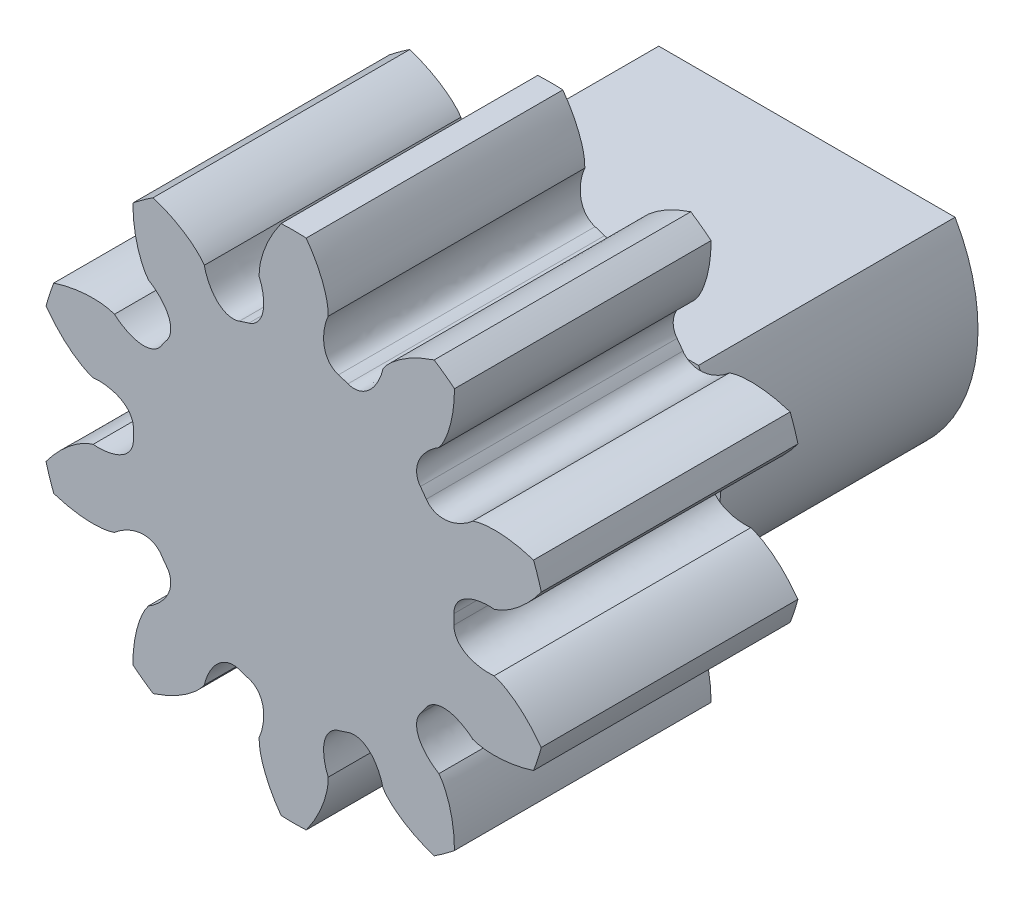
from build123d import *

# Parameters (mm, degrees)
EXTRUDE1_DEPTH = 3
EXTRUDE2_DEPTH = 3


with BuildPart() as part:
    # Sketch1 → Extrude1 (new body)
    with BuildSketch(Plane.XY):
        with BuildLine():
            ThreePointArc((0.146869466, 2.996402737), (0, 3), (-0.146869466, 2.996402737))
            add(Edge.make_bspline(
                [(-0.403675521, 2.333059462), (-0.404112154, 2.357105824), (-0.403176148, 2.381017719), (-0.400867501, 2.404795148), (-0.398490101, 2.429280686), (-0.394229221, 2.453688668), (-0.389368459, 2.477823976), (-0.384368962, 2.502648149), (-0.378071017, 2.52728395), (-0.37110821, 2.551637524), (-0.363952642, 2.57666531), (-0.355730807, 2.601447428), (-0.346865799, 2.625925798), (-0.337762187, 2.651063015), (-0.327724849, 2.675913559), (-0.317074003, 2.700437741), (-0.306144112, 2.725604439), (-0.294369, 2.750450842), (-0.282008887, 2.774948568), (-0.269333286, 2.800071589), (-0.255877409, 2.824844721), (-0.241862673, 2.84924737), (-0.227499168, 2.874257301), (-0.212406272, 2.898890217), (-0.196778524, 2.923131338), (-0.180771343, 2.94796102), (-0.164134991, 2.972384819), (-0.146869466, 2.996402737)],
                knots=[0, 0, 0, 0, 1, 1, 1, 2, 2, 2, 3, 3, 3, 4, 4, 4, 5, 5, 5, 6, 6, 6, 7, 7, 7, 8, 8, 8, 9, 9, 9, 9], degree=3))
            add(Edge.make_bspline(
                [(-0.403675521, 2.333059462), (-0.376621923, 2.271449066), (-0.359934026, 2.20843606), (-0.35361183, 2.144020444), (-0.350157456, 2.10882451), (-0.34847292, 2.072375297), (-0.352532441, 2.037176436), (-0.355230365, 2.01378356), (-0.359422143, 1.990035741), (-0.366482017, 1.967548774), (-0.371817308, 1.950554917), (-0.378380637, 1.93360758), (-0.386617062, 1.917804668), (-0.393411471, 1.904768498), (-0.4012285, 1.892002799), (-0.410113034, 1.880285367), (-0.417906201, 1.870007293), (-0.426560171, 1.860148599), (-0.435922052, 1.851272347), (-0.444507734, 1.843132029), (-0.453819157, 1.835524868), (-0.46359386, 1.828856684), (-0.472867368, 1.822530409), (-0.482746479, 1.816834329), (-0.492901586, 1.81204805), (-0.502806968, 1.80737947), (-0.51307947, 1.803487822), (-0.523719093, 1.800373103)],
                knots=[0, 0, 0, 0, 1, 1, 1, 2, 2, 2, 3, 3, 3, 4, 4, 4, 5, 5, 5, 6, 6, 6, 7, 7, 7, 8, 8, 8, 9, 9, 9, 9], degree=3))
            ThreePointArc((-0.523719093, 1.800373103), (-0.579406864, 1.783230968), (-0.634535112, 1.764366796))
            add(Edge.make_bspline(
                [(-1.044757588, 2.124759272), (-1.030430726, 2.059013708), (-1.006893403, 1.998226216), (-0.974145618, 1.942396794), (-0.956252614, 1.911892256), (-0.936191122, 1.881414077), (-0.91221753, 1.855323727), (-0.896284875, 1.837984293), (-0.878935038, 1.821235769), (-0.860005972, 1.80719312), (-0.845700893, 1.796580806), (-0.830429654, 1.786727951), (-0.814477527, 1.778784376), (-0.801318267, 1.772231546), (-0.787490667, 1.766498613), (-0.773415595, 1.762241209), (-0.76106949, 1.758506781), (-0.748273487, 1.755617607), (-0.735482235, 1.753939343), (-0.723751514, 1.752400224), (-0.711747037, 1.75171902), (-0.699919676, 1.752069771), (-0.688698759, 1.752402538), (-0.677358319, 1.753601109), (-0.666329361, 1.75569795), (-0.655571616, 1.757743227), (-0.644973533, 1.760632843), (-0.634535112, 1.764366796)],
                knots=[0, 0, 0, 0, 1, 1, 1, 2, 2, 2, 3, 3, 3, 4, 4, 4, 5, 5, 5, 6, 6, 6, 7, 7, 7, 8, 8, 8, 9, 9, 9, 9], degree=3))
            add(Edge.make_bspline(
                [(-1.044757588, 2.124759272), (-1.058538441, 2.144469834), (-1.073350746, 2.163264793), (-1.089194502, 2.181144148), (-1.105510097, 2.199555963), (-1.123303874, 2.216797953), (-1.141422691, 2.233466743), (-1.160058651, 2.25061129), (-1.179634356, 2.266840233), (-1.199582058, 2.282450053), (-1.220081997, 2.29849202), (-1.241300165, 2.313708501), (-1.262860131, 2.328301198), (-1.285000394, 2.343286664), (-1.307727555, 2.357491378), (-1.330759222, 2.371071447), (-1.354394303, 2.385007305), (-1.378524918, 2.39818723), (-1.402923862, 2.410741214), (-1.42794558, 2.423615635), (-1.453392895, 2.435748353), (-1.479074571, 2.447252856), (-1.505395359, 2.459043659), (-1.532084634, 2.470100724), (-1.558976321, 2.480526444), (-1.586520923, 2.491205293), (-1.614335964, 2.501185959), (-1.642421445, 2.510468442)],
                knots=[0, 0, 0, 0, 1, 1, 1, 2, 2, 2, 3, 3, 3, 4, 4, 4, 5, 5, 5, 6, 6, 6, 7, 7, 7, 8, 8, 8, 9, 9, 9, 9], degree=3))
            ThreePointArc((-1.642421445, 2.510468442), (-1.763355757, 2.427050983), (-1.880061232, 2.33781303))
            add(Edge.make_bspline(
                [(-1.697918301, 1.650210236), (-1.712405642, 1.669407505), (-1.725703456, 1.689302805), (-1.737811744, 1.709896138), (-1.750280624, 1.731102754), (-1.761180152, 1.75335371), (-1.771434091, 1.775736668), (-1.781980695, 1.798758476), (-1.791366112, 1.822391097), (-1.800047754, 1.846186188), (-1.808969742, 1.87064003), (-1.816884701, 1.895521857), (-1.824100784, 1.920535995), (-1.831511092, 1.9462234), (-1.837997499, 1.972227712), (-1.843795736, 1.998328602), (-1.849745882, 2.025113317), (-1.854823965, 2.052135716), (-1.859223826, 2.079219885), (-1.863735991, 2.106995368), (-1.867411239, 2.134946419), (-1.870416597, 2.162926231), (-1.873496746, 2.191602347), (-1.875765201, 2.220402176), (-1.877370661, 2.249199415), (-1.8790151, 2.278695834), (-1.879911958, 2.308233706), (-1.880061232, 2.33781303)],
                knots=[0, 0, 0, 0, 1, 1, 1, 2, 2, 2, 3, 3, 3, 4, 4, 4, 5, 5, 5, 6, 6, 6, 7, 7, 7, 8, 8, 8, 9, 9, 9, 9], degree=3))
            add(Edge.make_bspline(
                [(-1.697918301, 1.650210236), (-1.639817798, 1.616268084), (-1.589278891, 1.575098391), (-1.546301577, 1.526701157), (-1.522819279, 1.500257478), (-1.500032151, 1.471759591), (-1.482627001, 1.440896988), (-1.47105968, 1.420385953), (-1.460492282, 1.398709699), (-1.452986332, 1.37636767), (-1.447313934, 1.359483346), (-1.442662385, 1.341914835), (-1.440037074, 1.324288761), (-1.437871398, 1.309748625), (-1.436692017, 1.294826222), (-1.436992423, 1.280124423), (-1.437255927, 1.267228578), (-1.438462341, 1.254166051), (-1.440818931, 1.241482237), (-1.442980135, 1.229850044), (-1.446041858, 1.218222604), (-1.450030298, 1.207082504), (-1.453814233, 1.196513608), (-1.45845853, 1.186098587), (-1.463860879, 1.176257384), (-1.46913038, 1.166658186), (-1.475153555, 1.157471751), (-1.481930406, 1.148698077)],
                knots=[0, 0, 0, 0, 1, 1, 1, 2, 2, 2, 3, 3, 3, 4, 4, 4, 5, 5, 5, 6, 6, 6, 7, 7, 7, 8, 8, 8, 9, 9, 9, 9], degree=3))
            ThreePointArc((-1.481930406, 1.148698077), (-1.516906864, 1.102097348), (-1.550418472, 1.054432342))
            add(Edge.make_bspline(
                [(-2.094128808, 1.104873257), (-2.043893861, 1.060105097), (-1.989121775, 1.024761874), (-1.92981255, 0.998843588), (-1.897406688, 0.984682142), (-1.863261976, 0.971816627), (-1.828531409, 0.964800414), (-1.805449757, 0.960137497), (-1.781568909, 0.956785635), (-1.758000911, 0.956551119), (-1.740190097, 0.956373891), (-1.722044042, 0.957378974), (-1.704469384, 0.960328911), (-1.689971662, 0.962762379), (-1.675415165, 0.966251998), (-1.661525754, 0.971080806), (-1.649342503, 0.975316449), (-1.637292105, 0.980500359), (-1.625957306, 0.986661124), (-1.615562282, 0.992311096), (-1.605450055, 0.998816044), (-1.596087685, 1.006051757), (-1.587205368, 1.012916461), (-1.578735262, 1.020551868), (-1.571045139, 1.028730907), (-1.563544125, 1.036708815), (-1.556668569, 1.045275959), (-1.550418472, 1.054432342)],
                knots=[0, 0, 0, 0, 1, 1, 1, 2, 2, 2, 3, 3, 3, 4, 4, 4, 5, 5, 5, 6, 6, 6, 7, 7, 7, 8, 8, 8, 9, 9, 9, 9], degree=3))
            add(Edge.make_bspline(
                [(-2.094128808, 1.104873257), (-2.11686333, 1.112719255), (-2.139894136, 1.119218242), (-2.163221226, 1.124370218), (-2.187243013, 1.129675623), (-2.211773068, 1.133165767), (-2.236229168, 1.136001127), (-2.261383288, 1.138917414), (-2.286759499, 1.140540595), (-2.312072751, 1.14144424), (-2.338086782, 1.142372901), (-2.364196663, 1.142211567), (-2.390216415, 1.141344676), (-2.416936499, 1.140454453), (-2.44367248, 1.138587618), (-2.470287655, 1.136036451), (-2.497600129, 1.133418444), (-2.524869172, 1.129897608), (-2.551987379, 1.125712655), (-2.579797768, 1.121420883), (-2.607516512, 1.116278902), (-2.635055602, 1.11049093), (-2.663280026, 1.104558919), (-2.691371283, 1.097816711), (-2.719255199, 1.090444758), (-2.74781612, 1.082893818), (-2.77618545, 1.074619075), (-2.804363187, 1.06562053)],
                knots=[0, 0, 0, 0, 1, 1, 1, 2, 2, 2, 3, 3, 3, 4, 4, 4, 5, 5, 5, 6, 6, 6, 7, 7, 7, 8, 8, 8, 9, 9, 9, 9], degree=3))
            ThreePointArc((-2.804363187, 1.06562053), (-2.853169549, 0.927050983), (-2.895133509, 0.786258205))
            add(Edge.make_bspline(
                [(-2.343614001, 0.337036788), (-2.366618377, 0.344052259), (-2.389070699, 0.352331637), (-2.410970967, 0.36187492), (-2.433523439, 0.371702409), (-2.455420126, 0.383297228), (-2.476872109, 0.395378308), (-2.498936371, 0.407804203), (-2.520420238, 0.421406785), (-2.541430238, 0.435554477), (-2.563021885, 0.450093838), (-2.584050393, 0.465571363), (-2.604591269, 0.481566719), (-2.625685011, 0.497992596), (-2.646217575, 0.515217913), (-2.666250166, 0.532925858), (-2.686807596, 0.551097739), (-2.706799219, 0.569974497), (-2.726278456, 0.589299877), (-2.746254894, 0.60911853), (-2.765657447, 0.629571148), (-2.784534954, 0.650440787), (-2.803882245, 0.671829786), (-2.822645579, 0.693795973), (-2.840871015, 0.716149763), (-2.859538955, 0.73904629), (-2.877626453, 0.762415771), (-2.895133509, 0.786258205)],
                knots=[0, 0, 0, 0, 1, 1, 1, 2, 2, 2, 3, 3, 3, 4, 4, 4, 5, 5, 5, 6, 6, 6, 7, 7, 7, 8, 8, 8, 9, 9, 9, 9], degree=3))
            add(Edge.make_bspline(
                [(-2.343614001, 0.337036788), (-2.27665901, 0.343727629), (-2.211573237, 0.340126673), (-2.148356679, 0.326233919), (-2.113815897, 0.318643082), (-2.078630085, 0.308981744), (-2.04640844, 0.294243864), (-2.024994197, 0.284449189), (-2.00370401, 0.273124092), (-1.984499254, 0.259460898), (-1.969985831, 0.249135345), (-1.955896137, 0.237656232), (-1.943411869, 0.224939558), (-1.933113322, 0.214449293), (-1.923388016, 0.203070039), (-1.914989548, 0.190999459), (-1.90762274, 0.180411618), (-1.900920789, 0.169134699), (-1.895371951, 0.157488109), (-1.89028317, 0.146807143), (-1.885925718, 0.135600711), (-1.882604448, 0.124243834), (-1.879453474, 0.113469277), (-1.877088993, 0.102313499), (-1.875675072, 0.091176377), (-1.874295921, 0.080313129), (-1.87376912, 0.069340813), (-1.874094672, 0.058259429)],
                knots=[0, 0, 0, 0, 1, 1, 1, 2, 2, 2, 3, 3, 3, 4, 4, 4, 5, 5, 5, 6, 6, 6, 7, 7, 7, 8, 8, 8, 9, 9, 9, 9], degree=3))
            ThreePointArc((-1.874094672, 0.058259429), (-1.875, 0), (-1.874094672, -0.058259429))
            add(Edge.make_bspline(
                [(-2.343614001, -0.337036788), (-2.27665901, -0.343727629), (-2.211573237, -0.340126673), (-2.148356679, -0.326233919), (-2.113815897, -0.318643082), (-2.078630085, -0.308981744), (-2.04640844, -0.294243864), (-2.024994197, -0.284449189), (-2.00370401, -0.273124092), (-1.984499254, -0.259460898), (-1.969985831, -0.249135345), (-1.955896137, -0.237656232), (-1.943411869, -0.224939558), (-1.933113322, -0.214449293), (-1.923388016, -0.203070039), (-1.914989548, -0.190999459), (-1.90762274, -0.180411618), (-1.900920789, -0.169134699), (-1.895371951, -0.157488109), (-1.89028317, -0.146807143), (-1.885925718, -0.135600711), (-1.882604448, -0.124243834), (-1.879453474, -0.113469277), (-1.877088993, -0.102313499), (-1.875675072, -0.091176377), (-1.874295921, -0.080313129), (-1.87376912, -0.069340813), (-1.874094672, -0.058259429)],
                knots=[0, 0, 0, 0, 1, 1, 1, 2, 2, 2, 3, 3, 3, 4, 4, 4, 5, 5, 5, 6, 6, 6, 7, 7, 7, 8, 8, 8, 9, 9, 9, 9], degree=3))
            add(Edge.make_bspline(
                [(-2.343614001, -0.337036788), (-2.366618377, -0.344052259), (-2.389070699, -0.352331637), (-2.410970967, -0.36187492), (-2.433523439, -0.371702409), (-2.455420126, -0.383297228), (-2.476872109, -0.395378308), (-2.498936371, -0.407804203), (-2.520420238, -0.421406785), (-2.541430238, -0.435554477), (-2.563021885, -0.450093838), (-2.584050393, -0.465571363), (-2.604591269, -0.481566719), (-2.625685011, -0.497992596), (-2.646217575, -0.515217913), (-2.666250166, -0.532925858), (-2.686807596, -0.551097739), (-2.706799219, -0.569974497), (-2.726278456, -0.589299877), (-2.746254894, -0.60911853), (-2.765657447, -0.629571148), (-2.784534954, -0.650440787), (-2.803882245, -0.671829786), (-2.822645579, -0.693795973), (-2.840871015, -0.716149763), (-2.859538955, -0.73904629), (-2.877626453, -0.762415771), (-2.895133509, -0.786258205)],
                knots=[0, 0, 0, 0, 1, 1, 1, 2, 2, 2, 3, 3, 3, 4, 4, 4, 5, 5, 5, 6, 6, 6, 7, 7, 7, 8, 8, 8, 9, 9, 9, 9], degree=3))
            ThreePointArc((-2.895133509, -0.786258205), (-2.853169549, -0.927050983), (-2.804363187, -1.06562053))
            add(Edge.make_bspline(
                [(-2.094128808, -1.104873257), (-2.11686333, -1.112719255), (-2.139894136, -1.119218242), (-2.163221226, -1.124370218), (-2.187243013, -1.129675623), (-2.211773068, -1.133165767), (-2.236229168, -1.136001127), (-2.261383288, -1.138917414), (-2.286759499, -1.140540595), (-2.312072751, -1.14144424), (-2.338086782, -1.142372901), (-2.364196663, -1.142211567), (-2.390216415, -1.141344676), (-2.416936499, -1.140454453), (-2.44367248, -1.138587618), (-2.470287655, -1.136036451), (-2.497600129, -1.133418444), (-2.524869172, -1.129897608), (-2.551987379, -1.125712655), (-2.579797768, -1.121420883), (-2.607516512, -1.116278902), (-2.635055602, -1.11049093), (-2.663280026, -1.104558919), (-2.691371283, -1.097816711), (-2.719255199, -1.090444758), (-2.74781612, -1.082893818), (-2.77618545, -1.074619075), (-2.804363187, -1.06562053)],
                knots=[0, 0, 0, 0, 1, 1, 1, 2, 2, 2, 3, 3, 3, 4, 4, 4, 5, 5, 5, 6, 6, 6, 7, 7, 7, 8, 8, 8, 9, 9, 9, 9], degree=3))
            add(Edge.make_bspline(
                [(-2.094128808, -1.104873257), (-2.043893861, -1.060105097), (-1.989121775, -1.024761874), (-1.92981255, -0.998843588), (-1.897406688, -0.984682142), (-1.863261976, -0.971816627), (-1.828531409, -0.964800414), (-1.805449757, -0.960137497), (-1.781568909, -0.956785635), (-1.758000911, -0.956551119), (-1.740190097, -0.956373891), (-1.722044042, -0.957378974), (-1.704469384, -0.960328911), (-1.689971662, -0.962762379), (-1.675415165, -0.966251998), (-1.661525754, -0.971080806), (-1.649342503, -0.975316449), (-1.637292105, -0.980500359), (-1.625957306, -0.986661124), (-1.615562282, -0.992311096), (-1.605450055, -0.998816044), (-1.596087685, -1.006051757), (-1.587205368, -1.012916461), (-1.578735262, -1.020551868), (-1.571045139, -1.028730907), (-1.563544125, -1.036708815), (-1.556668569, -1.045275959), (-1.550418472, -1.054432342)],
                knots=[0, 0, 0, 0, 1, 1, 1, 2, 2, 2, 3, 3, 3, 4, 4, 4, 5, 5, 5, 6, 6, 6, 7, 7, 7, 8, 8, 8, 9, 9, 9, 9], degree=3))
            ThreePointArc((-1.550418472, -1.054432342), (-1.516906864, -1.102097348), (-1.481930406, -1.148698077))
            add(Edge.make_bspline(
                [(-1.697918301, -1.650210236), (-1.639817798, -1.616268084), (-1.589278891, -1.575098391), (-1.546301577, -1.526701157), (-1.522819279, -1.500257478), (-1.500032151, -1.471759591), (-1.482627001, -1.440896988), (-1.47105968, -1.420385953), (-1.460492282, -1.398709699), (-1.452986332, -1.37636767), (-1.447313934, -1.359483346), (-1.442662385, -1.341914835), (-1.440037074, -1.324288761), (-1.437871398, -1.309748625), (-1.436692017, -1.294826222), (-1.436992423, -1.280124423), (-1.437255927, -1.267228578), (-1.438462341, -1.254166051), (-1.440818931, -1.241482237), (-1.442980135, -1.229850044), (-1.446041858, -1.218222604), (-1.450030298, -1.207082504), (-1.453814233, -1.196513608), (-1.45845853, -1.186098587), (-1.463860879, -1.176257384), (-1.46913038, -1.166658186), (-1.475153555, -1.157471751), (-1.481930406, -1.148698077)],
                knots=[0, 0, 0, 0, 1, 1, 1, 2, 2, 2, 3, 3, 3, 4, 4, 4, 5, 5, 5, 6, 6, 6, 7, 7, 7, 8, 8, 8, 9, 9, 9, 9], degree=3))
            add(Edge.make_bspline(
                [(-1.697918301, -1.650210236), (-1.712405642, -1.669407505), (-1.725703456, -1.689302805), (-1.737811744, -1.709896138), (-1.750280624, -1.731102754), (-1.761180152, -1.75335371), (-1.771434091, -1.775736668), (-1.781980695, -1.798758476), (-1.791366112, -1.822391097), (-1.800047754, -1.846186188), (-1.808969742, -1.87064003), (-1.816884701, -1.895521857), (-1.824100784, -1.920535995), (-1.831511092, -1.9462234), (-1.837997499, -1.972227712), (-1.843795736, -1.998328602), (-1.849745882, -2.025113317), (-1.854823965, -2.052135716), (-1.859223826, -2.079219885), (-1.863735991, -2.106995368), (-1.867411239, -2.134946419), (-1.870416597, -2.162926231), (-1.873496746, -2.191602347), (-1.875765201, -2.220402176), (-1.877370661, -2.249199415), (-1.8790151, -2.278695834), (-1.879911958, -2.308233706), (-1.880061232, -2.33781303)],
                knots=[0, 0, 0, 0, 1, 1, 1, 2, 2, 2, 3, 3, 3, 4, 4, 4, 5, 5, 5, 6, 6, 6, 7, 7, 7, 8, 8, 8, 9, 9, 9, 9], degree=3))
            ThreePointArc((-1.880061232, -2.33781303), (-1.763355757, -2.427050983), (-1.642421445, -2.510468442))
            add(Edge.make_bspline(
                [(-1.044757588, -2.124759272), (-1.058538441, -2.144469834), (-1.073350746, -2.163264793), (-1.089194502, -2.181144148), (-1.105510097, -2.199555963), (-1.123303874, -2.216797953), (-1.141422691, -2.233466743), (-1.160058651, -2.25061129), (-1.179634356, -2.266840233), (-1.199582058, -2.282450053), (-1.220081997, -2.29849202), (-1.241300165, -2.313708501), (-1.262860131, -2.328301198), (-1.285000394, -2.343286664), (-1.307727555, -2.357491378), (-1.330759222, -2.371071447), (-1.354394303, -2.385007305), (-1.378524918, -2.39818723), (-1.402923862, -2.410741214), (-1.42794558, -2.423615635), (-1.453392895, -2.435748353), (-1.479074571, -2.447252856), (-1.505395359, -2.459043659), (-1.532084634, -2.470100724), (-1.558976321, -2.480526444), (-1.586520923, -2.491205293), (-1.614335964, -2.501185959), (-1.642421445, -2.510468442)],
                knots=[0, 0, 0, 0, 1, 1, 1, 2, 2, 2, 3, 3, 3, 4, 4, 4, 5, 5, 5, 6, 6, 6, 7, 7, 7, 8, 8, 8, 9, 9, 9, 9], degree=3))
            add(Edge.make_bspline(
                [(-1.044757588, -2.124759272), (-1.030430726, -2.059013708), (-1.006893403, -1.998226216), (-0.974145618, -1.942396794), (-0.956252614, -1.911892256), (-0.936191122, -1.881414077), (-0.91221753, -1.855323727), (-0.896284875, -1.837984293), (-0.878935038, -1.821235769), (-0.860005972, -1.80719312), (-0.845700893, -1.796580806), (-0.830429654, -1.786727951), (-0.814477527, -1.778784376), (-0.801318267, -1.772231546), (-0.787490667, -1.766498613), (-0.773415595, -1.762241209), (-0.76106949, -1.758506781), (-0.748273487, -1.755617607), (-0.735482235, -1.753939343), (-0.723751514, -1.752400224), (-0.711747037, -1.75171902), (-0.699919676, -1.752069771), (-0.688698759, -1.752402538), (-0.677358319, -1.753601109), (-0.666329361, -1.75569795), (-0.655571616, -1.757743227), (-0.644973533, -1.760632843), (-0.634535112, -1.764366796)],
                knots=[0, 0, 0, 0, 1, 1, 1, 2, 2, 2, 3, 3, 3, 4, 4, 4, 5, 5, 5, 6, 6, 6, 7, 7, 7, 8, 8, 8, 9, 9, 9, 9], degree=3))
            ThreePointArc((-0.634535112, -1.764366796), (-0.579406864, -1.783230968), (-0.523719093, -1.800373103))
            add(Edge.make_bspline(
                [(-0.403675521, -2.333059462), (-0.376621923, -2.271449066), (-0.359934026, -2.20843606), (-0.35361183, -2.144020444), (-0.350157456, -2.10882451), (-0.34847292, -2.072375297), (-0.352532441, -2.037176436), (-0.355230365, -2.01378356), (-0.359422143, -1.990035741), (-0.366482017, -1.967548774), (-0.371817308, -1.950554917), (-0.378380637, -1.93360758), (-0.386617062, -1.917804668), (-0.393411471, -1.904768498), (-0.4012285, -1.892002799), (-0.410113034, -1.880285367), (-0.417906201, -1.870007293), (-0.426560171, -1.860148599), (-0.435922052, -1.851272347), (-0.444507734, -1.843132029), (-0.453819157, -1.835524868), (-0.46359386, -1.828856684), (-0.472867368, -1.822530409), (-0.482746479, -1.816834329), (-0.492901586, -1.81204805), (-0.502806968, -1.80737947), (-0.51307947, -1.803487822), (-0.523719093, -1.800373103)],
                knots=[0, 0, 0, 0, 1, 1, 1, 2, 2, 2, 3, 3, 3, 4, 4, 4, 5, 5, 5, 6, 6, 6, 7, 7, 7, 8, 8, 8, 9, 9, 9, 9], degree=3))
            add(Edge.make_bspline(
                [(-0.403675521, -2.333059462), (-0.404112154, -2.357105824), (-0.403176148, -2.381017719), (-0.400867501, -2.404795148), (-0.398490101, -2.429280686), (-0.394229221, -2.453688668), (-0.389368459, -2.477823976), (-0.384368962, -2.502648149), (-0.378071017, -2.52728395), (-0.37110821, -2.551637524), (-0.363952642, -2.57666531), (-0.355730807, -2.601447428), (-0.346865799, -2.625925798), (-0.337762187, -2.651063015), (-0.327724849, -2.675913559), (-0.317074003, -2.700437741), (-0.306144112, -2.725604439), (-0.294369, -2.750450842), (-0.282008887, -2.774948568), (-0.269333286, -2.800071589), (-0.255877409, -2.824844721), (-0.241862673, -2.84924737), (-0.227499168, -2.874257301), (-0.212406272, -2.898890217), (-0.196778524, -2.923131338), (-0.180771343, -2.94796102), (-0.164134991, -2.972384819), (-0.146869466, -2.996402737)],
                knots=[0, 0, 0, 0, 1, 1, 1, 2, 2, 2, 3, 3, 3, 4, 4, 4, 5, 5, 5, 6, 6, 6, 7, 7, 7, 8, 8, 8, 9, 9, 9, 9], degree=3))
            ThreePointArc((-0.146869466, -2.996402737), (0, -3), (0.146869466, -2.996402737))
            add(Edge.make_bspline(
                [(0.403675521, -2.333059462), (0.404112154, -2.357105824), (0.403176148, -2.381017719), (0.400867501, -2.404795148), (0.398490101, -2.429280686), (0.394229221, -2.453688668), (0.389368459, -2.477823976), (0.384368962, -2.502648149), (0.378071017, -2.52728395), (0.37110821, -2.551637524), (0.363952642, -2.57666531), (0.355730807, -2.601447428), (0.346865799, -2.625925798), (0.337762187, -2.651063015), (0.327724849, -2.675913559), (0.317074003, -2.700437741), (0.306144112, -2.725604439), (0.294369, -2.750450842), (0.282008887, -2.774948568), (0.269333286, -2.800071589), (0.255877409, -2.824844721), (0.241862673, -2.84924737), (0.227499168, -2.874257301), (0.212406272, -2.898890217), (0.196778524, -2.923131338), (0.180771343, -2.94796102), (0.164134991, -2.972384819), (0.146869466, -2.996402737)],
                knots=[0, 0, 0, 0, 1, 1, 1, 2, 2, 2, 3, 3, 3, 4, 4, 4, 5, 5, 5, 6, 6, 6, 7, 7, 7, 8, 8, 8, 9, 9, 9, 9], degree=3))
            add(Edge.make_bspline(
                [(0.403675521, -2.333059462), (0.376621923, -2.271449066), (0.359934026, -2.20843606), (0.35361183, -2.144020444), (0.350157456, -2.10882451), (0.34847292, -2.072375297), (0.352532441, -2.037176436), (0.355230365, -2.01378356), (0.359422143, -1.990035741), (0.366482017, -1.967548774), (0.371817308, -1.950554917), (0.378380637, -1.93360758), (0.386617062, -1.917804668), (0.393411471, -1.904768498), (0.4012285, -1.892002799), (0.410113034, -1.880285367), (0.417906201, -1.870007293), (0.426560171, -1.860148599), (0.435922052, -1.851272347), (0.444507734, -1.843132029), (0.453819157, -1.835524868), (0.46359386, -1.828856684), (0.472867368, -1.822530409), (0.482746479, -1.816834329), (0.492901586, -1.81204805), (0.502806968, -1.80737947), (0.51307947, -1.803487822), (0.523719093, -1.800373103)],
                knots=[0, 0, 0, 0, 1, 1, 1, 2, 2, 2, 3, 3, 3, 4, 4, 4, 5, 5, 5, 6, 6, 6, 7, 7, 7, 8, 8, 8, 9, 9, 9, 9], degree=3))
            ThreePointArc((0.523719093, -1.800373103), (0.579406864, -1.783230968), (0.634535112, -1.764366796))
            add(Edge.make_bspline(
                [(1.044757588, -2.124759272), (1.030430726, -2.059013708), (1.006893403, -1.998226216), (0.974145618, -1.942396794), (0.956252614, -1.911892256), (0.936191122, -1.881414077), (0.91221753, -1.855323727), (0.896284875, -1.837984293), (0.878935038, -1.821235769), (0.860005972, -1.80719312), (0.845700893, -1.796580806), (0.830429654, -1.786727951), (0.814477527, -1.778784376), (0.801318267, -1.772231546), (0.787490667, -1.766498613), (0.773415595, -1.762241209), (0.76106949, -1.758506781), (0.748273487, -1.755617607), (0.735482235, -1.753939343), (0.723751514, -1.752400224), (0.711747037, -1.75171902), (0.699919676, -1.752069771), (0.688698759, -1.752402538), (0.677358319, -1.753601109), (0.666329361, -1.75569795), (0.655571616, -1.757743227), (0.644973533, -1.760632843), (0.634535112, -1.764366796)],
                knots=[0, 0, 0, 0, 1, 1, 1, 2, 2, 2, 3, 3, 3, 4, 4, 4, 5, 5, 5, 6, 6, 6, 7, 7, 7, 8, 8, 8, 9, 9, 9, 9], degree=3))
            add(Edge.make_bspline(
                [(1.044757588, -2.124759272), (1.058538441, -2.144469834), (1.073350746, -2.163264793), (1.089194502, -2.181144148), (1.105510097, -2.199555963), (1.123303874, -2.216797953), (1.141422691, -2.233466743), (1.160058651, -2.25061129), (1.179634356, -2.266840233), (1.199582058, -2.282450053), (1.220081997, -2.29849202), (1.241300165, -2.313708501), (1.262860131, -2.328301198), (1.285000394, -2.343286664), (1.307727555, -2.357491378), (1.330759222, -2.371071447), (1.354394303, -2.385007305), (1.378524918, -2.39818723), (1.402923862, -2.410741214), (1.42794558, -2.423615635), (1.453392895, -2.435748353), (1.479074571, -2.447252856), (1.505395359, -2.459043659), (1.532084634, -2.470100724), (1.558976321, -2.480526444), (1.586520923, -2.491205293), (1.614335964, -2.501185959), (1.642421445, -2.510468442)],
                knots=[0, 0, 0, 0, 1, 1, 1, 2, 2, 2, 3, 3, 3, 4, 4, 4, 5, 5, 5, 6, 6, 6, 7, 7, 7, 8, 8, 8, 9, 9, 9, 9], degree=3))
            ThreePointArc((1.642421445, -2.510468442), (1.763355757, -2.427050983), (1.880061232, -2.33781303))
            add(Edge.make_bspline(
                [(1.697918301, -1.650210236), (1.712405642, -1.669407505), (1.725703456, -1.689302805), (1.737811744, -1.709896138), (1.750280624, -1.731102754), (1.761180152, -1.75335371), (1.771434091, -1.775736668), (1.781980695, -1.798758476), (1.791366112, -1.822391097), (1.800047754, -1.846186188), (1.808969742, -1.87064003), (1.816884701, -1.895521857), (1.824100784, -1.920535995), (1.831511092, -1.9462234), (1.837997499, -1.972227712), (1.843795736, -1.998328602), (1.849745882, -2.025113317), (1.854823965, -2.052135716), (1.859223826, -2.079219885), (1.863735991, -2.106995368), (1.867411239, -2.134946419), (1.870416597, -2.162926231), (1.873496746, -2.191602347), (1.875765201, -2.220402176), (1.877370661, -2.249199415), (1.8790151, -2.278695834), (1.879911958, -2.308233706), (1.880061232, -2.33781303)],
                knots=[0, 0, 0, 0, 1, 1, 1, 2, 2, 2, 3, 3, 3, 4, 4, 4, 5, 5, 5, 6, 6, 6, 7, 7, 7, 8, 8, 8, 9, 9, 9, 9], degree=3))
            add(Edge.make_bspline(
                [(1.697918301, -1.650210236), (1.639817798, -1.616268084), (1.589278891, -1.575098391), (1.546301577, -1.526701157), (1.522819279, -1.500257478), (1.500032151, -1.471759591), (1.482627001, -1.440896988), (1.47105968, -1.420385953), (1.460492282, -1.398709699), (1.452986332, -1.37636767), (1.447313934, -1.359483346), (1.442662385, -1.341914835), (1.440037074, -1.324288761), (1.437871398, -1.309748625), (1.436692017, -1.294826222), (1.436992423, -1.280124423), (1.437255927, -1.267228578), (1.438462341, -1.254166051), (1.440818931, -1.241482237), (1.442980135, -1.229850044), (1.446041858, -1.218222604), (1.450030298, -1.207082504), (1.453814233, -1.196513608), (1.45845853, -1.186098587), (1.463860879, -1.176257384), (1.46913038, -1.166658186), (1.475153555, -1.157471751), (1.481930406, -1.148698077)],
                knots=[0, 0, 0, 0, 1, 1, 1, 2, 2, 2, 3, 3, 3, 4, 4, 4, 5, 5, 5, 6, 6, 6, 7, 7, 7, 8, 8, 8, 9, 9, 9, 9], degree=3))
            ThreePointArc((1.481930406, -1.148698077), (1.516906864, -1.102097348), (1.550418472, -1.054432342))
            add(Edge.make_bspline(
                [(2.094128808, -1.104873257), (2.043893861, -1.060105097), (1.989121775, -1.024761874), (1.92981255, -0.998843588), (1.897406688, -0.984682142), (1.863261976, -0.971816627), (1.828531409, -0.964800414), (1.805449757, -0.960137497), (1.781568909, -0.956785635), (1.758000911, -0.956551119), (1.740190097, -0.956373891), (1.722044042, -0.957378974), (1.704469384, -0.960328911), (1.689971662, -0.962762379), (1.675415165, -0.966251998), (1.661525754, -0.971080806), (1.649342503, -0.975316449), (1.637292105, -0.980500359), (1.625957306, -0.986661124), (1.615562282, -0.992311096), (1.605450055, -0.998816044), (1.596087685, -1.006051757), (1.587205368, -1.012916461), (1.578735262, -1.020551868), (1.571045139, -1.028730907), (1.563544125, -1.036708815), (1.556668569, -1.045275959), (1.550418472, -1.054432342)],
                knots=[0, 0, 0, 0, 1, 1, 1, 2, 2, 2, 3, 3, 3, 4, 4, 4, 5, 5, 5, 6, 6, 6, 7, 7, 7, 8, 8, 8, 9, 9, 9, 9], degree=3))
            add(Edge.make_bspline(
                [(2.094128808, -1.104873257), (2.11686333, -1.112719255), (2.139894136, -1.119218242), (2.163221226, -1.124370218), (2.187243013, -1.129675623), (2.211773068, -1.133165767), (2.236229168, -1.136001127), (2.261383288, -1.138917414), (2.286759499, -1.140540595), (2.312072751, -1.14144424), (2.338086782, -1.142372901), (2.364196663, -1.142211567), (2.390216415, -1.141344676), (2.416936499, -1.140454453), (2.44367248, -1.138587618), (2.470287655, -1.136036451), (2.497600129, -1.133418444), (2.524869172, -1.129897608), (2.551987379, -1.125712655), (2.579797768, -1.121420883), (2.607516512, -1.116278902), (2.635055602, -1.11049093), (2.663280026, -1.104558919), (2.691371283, -1.097816711), (2.719255199, -1.090444758), (2.74781612, -1.082893818), (2.77618545, -1.074619075), (2.804363187, -1.06562053)],
                knots=[0, 0, 0, 0, 1, 1, 1, 2, 2, 2, 3, 3, 3, 4, 4, 4, 5, 5, 5, 6, 6, 6, 7, 7, 7, 8, 8, 8, 9, 9, 9, 9], degree=3))
            ThreePointArc((2.804363187, -1.06562053), (2.853169549, -0.927050983), (2.895133509, -0.786258205))
            add(Edge.make_bspline(
                [(2.343614001, -0.337036788), (2.366618377, -0.344052259), (2.389070699, -0.352331637), (2.410970967, -0.36187492), (2.433523439, -0.371702409), (2.455420126, -0.383297228), (2.476872109, -0.395378308), (2.498936371, -0.407804203), (2.520420238, -0.421406785), (2.541430238, -0.435554477), (2.563021885, -0.450093838), (2.584050393, -0.465571363), (2.604591269, -0.481566719), (2.625685011, -0.497992596), (2.646217575, -0.515217913), (2.666250166, -0.532925858), (2.686807596, -0.551097739), (2.706799219, -0.569974497), (2.726278456, -0.589299877), (2.746254894, -0.60911853), (2.765657447, -0.629571148), (2.784534954, -0.650440787), (2.803882245, -0.671829786), (2.822645579, -0.693795973), (2.840871015, -0.716149763), (2.859538955, -0.73904629), (2.877626453, -0.762415771), (2.895133509, -0.786258205)],
                knots=[0, 0, 0, 0, 1, 1, 1, 2, 2, 2, 3, 3, 3, 4, 4, 4, 5, 5, 5, 6, 6, 6, 7, 7, 7, 8, 8, 8, 9, 9, 9, 9], degree=3))
            add(Edge.make_bspline(
                [(2.343614001, -0.337036788), (2.27665901, -0.343727629), (2.211573237, -0.340126673), (2.148356679, -0.326233919), (2.113815897, -0.318643082), (2.078630085, -0.308981744), (2.04640844, -0.294243864), (2.024994197, -0.284449189), (2.00370401, -0.273124092), (1.984499254, -0.259460898), (1.969985831, -0.249135345), (1.955896137, -0.237656232), (1.943411869, -0.224939558), (1.933113322, -0.214449293), (1.923388016, -0.203070039), (1.914989548, -0.190999459), (1.90762274, -0.180411618), (1.900920789, -0.169134699), (1.895371951, -0.157488109), (1.89028317, -0.146807143), (1.885925718, -0.135600711), (1.882604448, -0.124243834), (1.879453474, -0.113469277), (1.877088993, -0.102313499), (1.875675072, -0.091176377), (1.874295921, -0.080313129), (1.87376912, -0.069340813), (1.874094672, -0.058259429)],
                knots=[0, 0, 0, 0, 1, 1, 1, 2, 2, 2, 3, 3, 3, 4, 4, 4, 5, 5, 5, 6, 6, 6, 7, 7, 7, 8, 8, 8, 9, 9, 9, 9], degree=3))
            ThreePointArc((1.874094672, -0.058259429), (1.875, 0), (1.874094672, 0.058259429))
            add(Edge.make_bspline(
                [(2.343614001, 0.337036788), (2.27665901, 0.343727629), (2.211573237, 0.340126673), (2.148356679, 0.326233919), (2.113815897, 0.318643082), (2.078630085, 0.308981744), (2.04640844, 0.294243864), (2.024994197, 0.284449189), (2.00370401, 0.273124092), (1.984499254, 0.259460898), (1.969985831, 0.249135345), (1.955896137, 0.237656232), (1.943411869, 0.224939558), (1.933113322, 0.214449293), (1.923388016, 0.203070039), (1.914989548, 0.190999459), (1.90762274, 0.180411618), (1.900920789, 0.169134699), (1.895371951, 0.157488109), (1.89028317, 0.146807143), (1.885925718, 0.135600711), (1.882604448, 0.124243834), (1.879453474, 0.113469277), (1.877088993, 0.102313499), (1.875675072, 0.091176377), (1.874295921, 0.080313129), (1.87376912, 0.069340813), (1.874094672, 0.058259429)],
                knots=[0, 0, 0, 0, 1, 1, 1, 2, 2, 2, 3, 3, 3, 4, 4, 4, 5, 5, 5, 6, 6, 6, 7, 7, 7, 8, 8, 8, 9, 9, 9, 9], degree=3))
            add(Edge.make_bspline(
                [(2.343614001, 0.337036788), (2.366618377, 0.344052259), (2.389070699, 0.352331637), (2.410970967, 0.36187492), (2.433523439, 0.371702409), (2.455420126, 0.383297228), (2.476872109, 0.395378308), (2.498936371, 0.407804203), (2.520420238, 0.421406785), (2.541430238, 0.435554477), (2.563021885, 0.450093838), (2.584050393, 0.465571363), (2.604591269, 0.481566719), (2.625685011, 0.497992596), (2.646217575, 0.515217913), (2.666250166, 0.532925858), (2.686807596, 0.551097739), (2.706799219, 0.569974497), (2.726278456, 0.589299877), (2.746254894, 0.60911853), (2.765657447, 0.629571148), (2.784534954, 0.650440787), (2.803882245, 0.671829786), (2.822645579, 0.693795973), (2.840871015, 0.716149763), (2.859538955, 0.73904629), (2.877626453, 0.762415771), (2.895133509, 0.786258205)],
                knots=[0, 0, 0, 0, 1, 1, 1, 2, 2, 2, 3, 3, 3, 4, 4, 4, 5, 5, 5, 6, 6, 6, 7, 7, 7, 8, 8, 8, 9, 9, 9, 9], degree=3))
            ThreePointArc((2.895133509, 0.786258205), (2.853169549, 0.927050983), (2.804363187, 1.06562053))
            add(Edge.make_bspline(
                [(2.094128808, 1.104873257), (2.11686333, 1.112719255), (2.139894136, 1.119218242), (2.163221226, 1.124370218), (2.187243013, 1.129675623), (2.211773068, 1.133165767), (2.236229168, 1.136001127), (2.261383288, 1.138917414), (2.286759499, 1.140540595), (2.312072751, 1.14144424), (2.338086782, 1.142372901), (2.364196663, 1.142211567), (2.390216415, 1.141344676), (2.416936499, 1.140454453), (2.44367248, 1.138587618), (2.470287655, 1.136036451), (2.497600129, 1.133418444), (2.524869172, 1.129897608), (2.551987379, 1.125712655), (2.579797768, 1.121420883), (2.607516512, 1.116278902), (2.635055602, 1.11049093), (2.663280026, 1.104558919), (2.691371283, 1.097816711), (2.719255199, 1.090444758), (2.74781612, 1.082893818), (2.77618545, 1.074619075), (2.804363187, 1.06562053)],
                knots=[0, 0, 0, 0, 1, 1, 1, 2, 2, 2, 3, 3, 3, 4, 4, 4, 5, 5, 5, 6, 6, 6, 7, 7, 7, 8, 8, 8, 9, 9, 9, 9], degree=3))
            add(Edge.make_bspline(
                [(2.094128808, 1.104873257), (2.043893861, 1.060105097), (1.989121775, 1.024761874), (1.92981255, 0.998843588), (1.897406688, 0.984682142), (1.863261976, 0.971816627), (1.828531409, 0.964800414), (1.805449757, 0.960137497), (1.781568909, 0.956785635), (1.758000911, 0.956551119), (1.740190097, 0.956373891), (1.722044042, 0.957378974), (1.704469384, 0.960328911), (1.689971662, 0.962762379), (1.675415165, 0.966251998), (1.661525754, 0.971080806), (1.649342503, 0.975316449), (1.637292105, 0.980500359), (1.625957306, 0.986661124), (1.615562282, 0.992311096), (1.605450055, 0.998816044), (1.596087685, 1.006051757), (1.587205368, 1.012916461), (1.578735262, 1.020551868), (1.571045139, 1.028730907), (1.563544125, 1.036708815), (1.556668569, 1.045275959), (1.550418472, 1.054432342)],
                knots=[0, 0, 0, 0, 1, 1, 1, 2, 2, 2, 3, 3, 3, 4, 4, 4, 5, 5, 5, 6, 6, 6, 7, 7, 7, 8, 8, 8, 9, 9, 9, 9], degree=3))
            ThreePointArc((1.550418472, 1.054432342), (1.516906864, 1.102097348), (1.481930406, 1.148698077))
            add(Edge.make_bspline(
                [(1.697918301, 1.650210236), (1.639817798, 1.616268084), (1.589278891, 1.575098391), (1.546301577, 1.526701157), (1.522819279, 1.500257478), (1.500032151, 1.471759591), (1.482627001, 1.440896988), (1.47105968, 1.420385953), (1.460492282, 1.398709699), (1.452986332, 1.37636767), (1.447313934, 1.359483346), (1.442662385, 1.341914835), (1.440037074, 1.324288761), (1.437871398, 1.309748625), (1.436692017, 1.294826222), (1.436992423, 1.280124423), (1.437255927, 1.267228578), (1.438462341, 1.254166051), (1.440818931, 1.241482237), (1.442980135, 1.229850044), (1.446041858, 1.218222604), (1.450030298, 1.207082504), (1.453814233, 1.196513608), (1.45845853, 1.186098587), (1.463860879, 1.176257384), (1.46913038, 1.166658186), (1.475153555, 1.157471751), (1.481930406, 1.148698077)],
                knots=[0, 0, 0, 0, 1, 1, 1, 2, 2, 2, 3, 3, 3, 4, 4, 4, 5, 5, 5, 6, 6, 6, 7, 7, 7, 8, 8, 8, 9, 9, 9, 9], degree=3))
            add(Edge.make_bspline(
                [(1.697918301, 1.650210236), (1.712405642, 1.669407505), (1.725703456, 1.689302805), (1.737811744, 1.709896138), (1.750280624, 1.731102754), (1.761180152, 1.75335371), (1.771434091, 1.775736668), (1.781980695, 1.798758476), (1.791366112, 1.822391097), (1.800047754, 1.846186188), (1.808969742, 1.87064003), (1.816884701, 1.895521857), (1.824100784, 1.920535995), (1.831511092, 1.9462234), (1.837997499, 1.972227712), (1.843795736, 1.998328602), (1.849745882, 2.025113317), (1.854823965, 2.052135716), (1.859223826, 2.079219885), (1.863735991, 2.106995368), (1.867411239, 2.134946419), (1.870416597, 2.162926231), (1.873496746, 2.191602347), (1.875765201, 2.220402176), (1.877370661, 2.249199415), (1.8790151, 2.278695834), (1.879911958, 2.308233706), (1.880061232, 2.33781303)],
                knots=[0, 0, 0, 0, 1, 1, 1, 2, 2, 2, 3, 3, 3, 4, 4, 4, 5, 5, 5, 6, 6, 6, 7, 7, 7, 8, 8, 8, 9, 9, 9, 9], degree=3))
            ThreePointArc((1.880061232, 2.33781303), (1.763355757, 2.427050983), (1.642421445, 2.510468442))
            add(Edge.make_bspline(
                [(1.044757588, 2.124759272), (1.058538441, 2.144469834), (1.073350746, 2.163264793), (1.089194502, 2.181144148), (1.105510097, 2.199555963), (1.123303874, 2.216797953), (1.141422691, 2.233466743), (1.160058651, 2.25061129), (1.179634356, 2.266840233), (1.199582058, 2.282450053), (1.220081997, 2.29849202), (1.241300165, 2.313708501), (1.262860131, 2.328301198), (1.285000394, 2.343286664), (1.307727555, 2.357491378), (1.330759222, 2.371071447), (1.354394303, 2.385007305), (1.378524918, 2.39818723), (1.402923862, 2.410741214), (1.42794558, 2.423615635), (1.453392895, 2.435748353), (1.479074571, 2.447252856), (1.505395359, 2.459043659), (1.532084634, 2.470100724), (1.558976321, 2.480526444), (1.586520923, 2.491205293), (1.614335964, 2.501185959), (1.642421445, 2.510468442)],
                knots=[0, 0, 0, 0, 1, 1, 1, 2, 2, 2, 3, 3, 3, 4, 4, 4, 5, 5, 5, 6, 6, 6, 7, 7, 7, 8, 8, 8, 9, 9, 9, 9], degree=3))
            add(Edge.make_bspline(
                [(1.044757588, 2.124759272), (1.030430726, 2.059013708), (1.006893403, 1.998226216), (0.974145618, 1.942396794), (0.956252614, 1.911892256), (0.936191122, 1.881414077), (0.91221753, 1.855323727), (0.896284875, 1.837984293), (0.878935038, 1.821235769), (0.860005972, 1.80719312), (0.845700893, 1.796580806), (0.830429654, 1.786727951), (0.814477527, 1.778784376), (0.801318267, 1.772231546), (0.787490667, 1.766498613), (0.773415595, 1.762241209), (0.76106949, 1.758506781), (0.748273487, 1.755617607), (0.735482235, 1.753939343), (0.723751514, 1.752400224), (0.711747037, 1.75171902), (0.699919676, 1.752069771), (0.688698759, 1.752402538), (0.677358319, 1.753601109), (0.666329361, 1.75569795), (0.655571616, 1.757743227), (0.644973533, 1.760632843), (0.634535112, 1.764366796)],
                knots=[0, 0, 0, 0, 1, 1, 1, 2, 2, 2, 3, 3, 3, 4, 4, 4, 5, 5, 5, 6, 6, 6, 7, 7, 7, 8, 8, 8, 9, 9, 9, 9], degree=3))
            ThreePointArc((0.634535112, 1.764366796), (0.579406864, 1.783230968), (0.523719093, 1.800373103))
            add(Edge.make_bspline(
                [(0.403675521, 2.333059462), (0.376621923, 2.271449066), (0.359934026, 2.20843606), (0.35361183, 2.144020444), (0.350157456, 2.10882451), (0.34847292, 2.072375297), (0.352532441, 2.037176436), (0.355230365, 2.01378356), (0.359422143, 1.990035741), (0.366482017, 1.967548774), (0.371817308, 1.950554917), (0.378380637, 1.93360758), (0.386617062, 1.917804668), (0.393411471, 1.904768498), (0.4012285, 1.892002799), (0.410113034, 1.880285367), (0.417906201, 1.870007293), (0.426560171, 1.860148599), (0.435922052, 1.851272347), (0.444507734, 1.843132029), (0.453819157, 1.835524868), (0.46359386, 1.828856684), (0.472867368, 1.822530409), (0.482746479, 1.816834329), (0.492901586, 1.81204805), (0.502806968, 1.80737947), (0.51307947, 1.803487822), (0.523719093, 1.800373103)],
                knots=[0, 0, 0, 0, 1, 1, 1, 2, 2, 2, 3, 3, 3, 4, 4, 4, 5, 5, 5, 6, 6, 6, 7, 7, 7, 8, 8, 8, 9, 9, 9, 9], degree=3))
            add(Edge.make_bspline(
                [(0.403675521, 2.333059462), (0.404112154, 2.357105824), (0.403176148, 2.381017719), (0.400867501, 2.404795148), (0.398490101, 2.429280686), (0.394229221, 2.453688668), (0.389368459, 2.477823976), (0.384368962, 2.502648149), (0.378071017, 2.52728395), (0.37110821, 2.551637524), (0.363952642, 2.57666531), (0.355730807, 2.601447428), (0.346865799, 2.625925798), (0.337762187, 2.651063015), (0.327724849, 2.675913559), (0.317074003, 2.700437741), (0.306144112, 2.725604439), (0.294369, 2.750450842), (0.282008887, 2.774948568), (0.269333286, 2.800071589), (0.255877409, 2.824844721), (0.241862673, 2.84924737), (0.227499168, 2.874257301), (0.212406272, 2.898890217), (0.196778524, 2.923131338), (0.180771343, 2.94796102), (0.164134991, 2.972384819), (0.146869466, 2.996402737)],
                knots=[0, 0, 0, 0, 1, 1, 1, 2, 2, 2, 3, 3, 3, 4, 4, 4, 5, 5, 5, 6, 6, 6, 7, 7, 7, 8, 8, 8, 9, 9, 9, 9], degree=3))
        make_face()
    extrude(amount=EXTRUDE1_DEPTH)

    # Sketch2 → Extrude2 (add)
    with BuildSketch(Plane(origin=(0, 0, 0), x_dir=(-1, 0, 0), z_dir=(0, 0, -1))):
        with BuildLine():
            ThreePointArc((-1.732050808, 1), (-1.732050808, -1), (0, -2))
            Line((0, -2), (0, 1))
            Line((0, 1), (-1.732050808, 1))
        make_face()
        with BuildLine():
            Line((0, 1), (0, -2))
            ThreePointArc((0, -2), (1.732050808, -1), (1.732050808, 1))
            Line((1.732050808, 1), (0, 1))
        make_face()
    extrude(amount=EXTRUDE2_DEPTH)


solid = part.part
